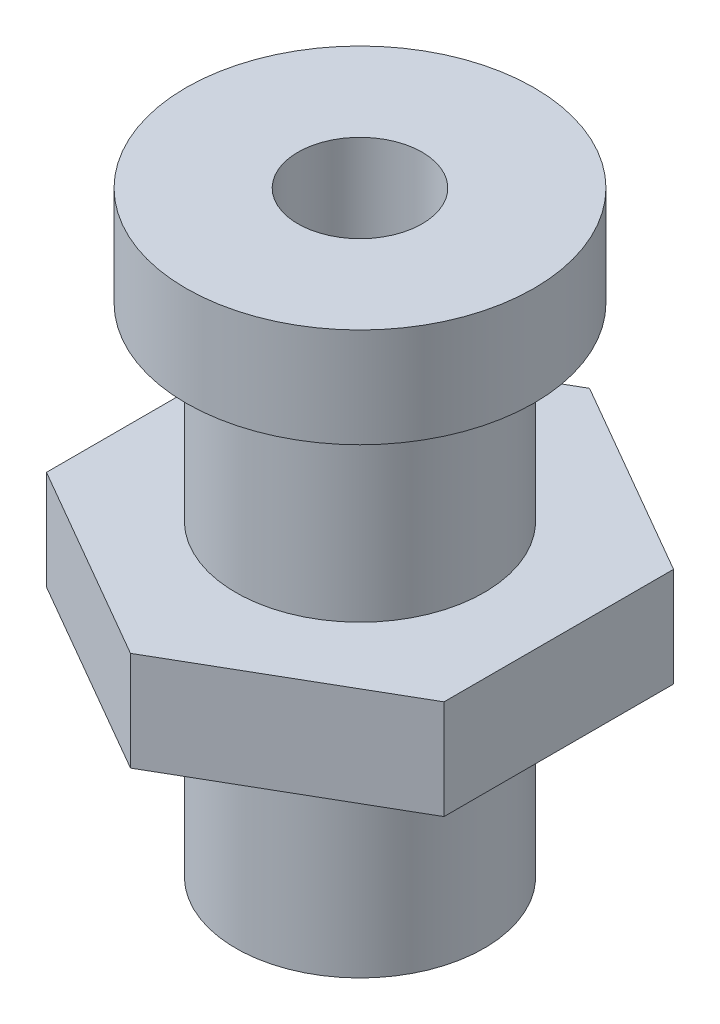
from build123d import *

# Parameters (mm, degrees)
ESQUISSE2_R        = 1.25
BOSS_EXTRU_1_DEPTH = 2
ESQUISSE3_R        = 2.5
ESQUISSE3_R_2      = 1.25
BOSS_EXTRU_2_DEPTH = 4.2


with BuildPart() as part:
    # Esquisse1 → Révolution1 (revolve)
    with BuildSketch(Plane.XY, mode=Mode.PRIVATE) as r_volution1_sk:
        Polygon((1.25, 0), (1.25, 5.8), (3.5, 5.8), (3.5, 3.8), (2.5, 3.8), (2.5, 0), align=None)
    revolve(r_volution1_sk.sketch.rotate(Axis((0, 0, 0), (0, 1, 0)), 90), axis=Axis((0, 0, 0), (0, 1, 0)))

    # Esquisse2 → Boss.-Extru.1 (add)
    with BuildSketch(Plane.XZ):
        Polygon((4, 2.309401077), (0, 4.618802154), (-4, 2.309401077), (-4, -2.309401077), (0, -4.618802154), (4, -2.309401077), align=None)
        with Locations(Location((0, 0, 0), (0, 0, 270))):
            Circle(ESQUISSE2_R, mode=Mode.SUBTRACT)
    extrude(amount=BOSS_EXTRU_1_DEPTH)

    # Esquisse3 → Boss.-Extru.2 (add)
    with BuildSketch(Plane.XZ.offset(2)):
        with Locations(Location((0, 0, 0), (0, 0, 270))):
            Circle(ESQUISSE3_R)
        with Locations(Location((0, 0, 0), (0, 0, 270))):
            Circle(ESQUISSE3_R_2, mode=Mode.SUBTRACT)
    extrude(amount=BOSS_EXTRU_2_DEPTH)


solid = part.part
